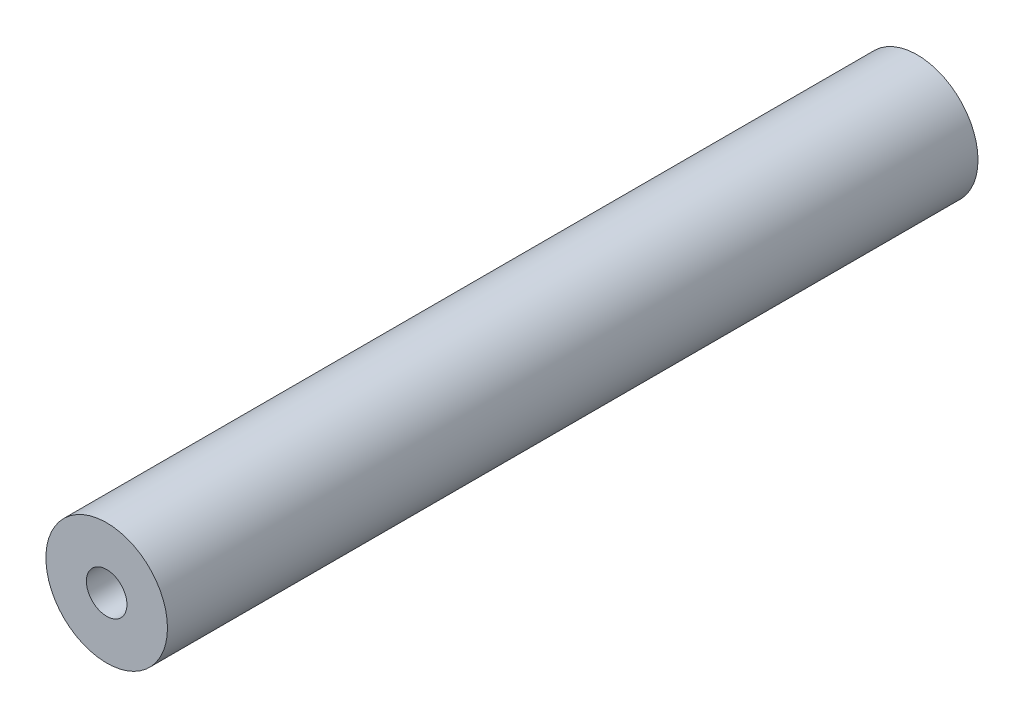
from build123d import *

# Parameters (mm, degrees)
SKETCH_1_R      = 7.5
SKETCH_1_R_2    = 2.5
EXTRUDE_1_DEPTH = 100


with BuildPart() as part:
    # 草图1 → 凸台-拉伸1 (new body)
    with BuildSketch(Plane.XY):
        Circle(SKETCH_1_R)
        Circle(SKETCH_1_R_2, mode=Mode.SUBTRACT)
    extrude(amount=EXTRUDE_1_DEPTH)


solid = part.part
